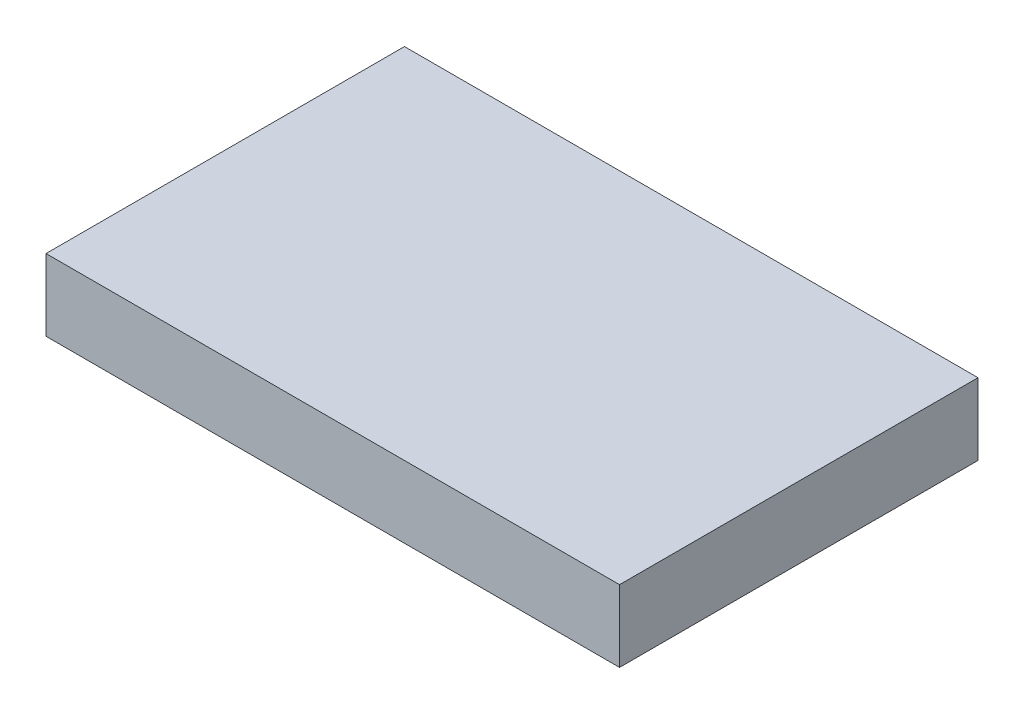
from build123d import *

# Parameters (mm, degrees)
SKETCH2_W           = 40
SKETCH2_H           = 25
BOSS_EXTRUDE1_DEPTH = 5


with BuildPart() as part:
    # Sketch2 → Boss-Extrude1 (new body)
    with BuildSketch(Plane(origin=(0, 0, 0), x_dir=(1, 0, 0), z_dir=(0, 1, 0))):
        with Locations((20, 12.5)):
            Rectangle(SKETCH2_W, SKETCH2_H)
    extrude(amount=BOSS_EXTRUDE1_DEPTH)


solid = part.part
